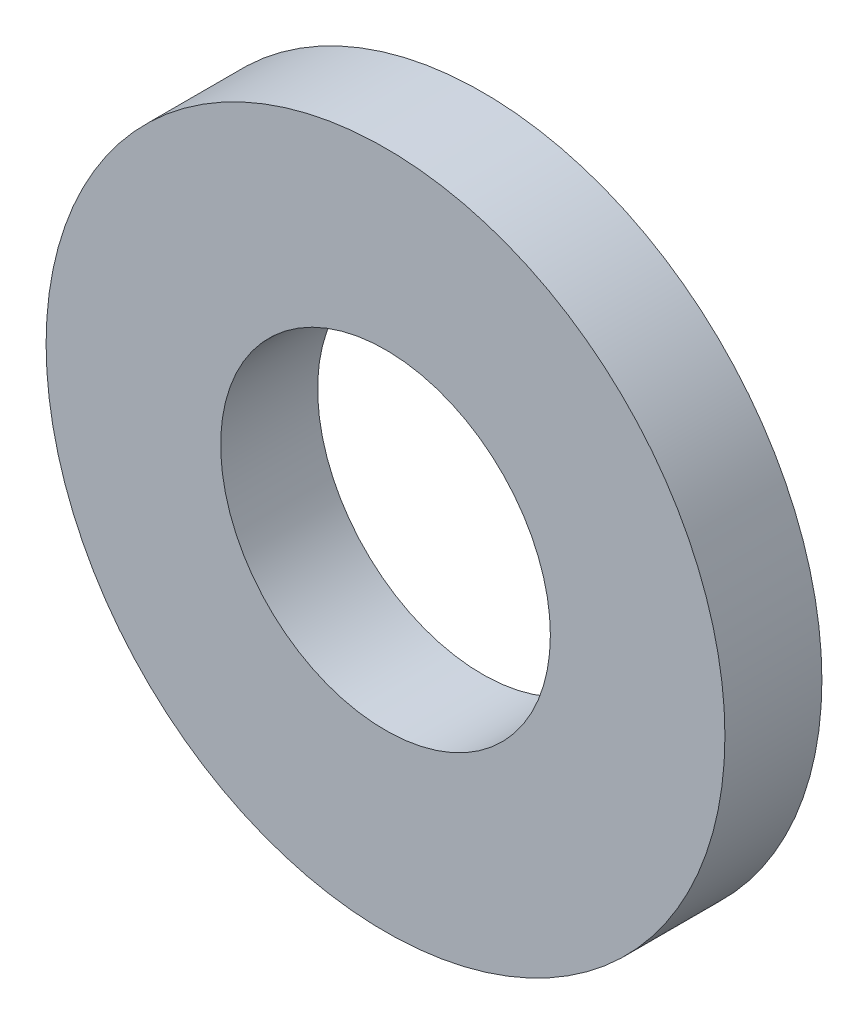
from build123d import *

# Parameters (mm, degrees)
SKETCH_1_R      = 3.5
SKETCH_1_R_2    = 1.7
EXTRUDE_1_DEPTH = 0.5


with BuildPart() as part:
    # 草图1 → 凸台-拉伸1 (new, symmetric)
    with BuildSketch(Plane.XY):
        Circle(SKETCH_1_R)
        Circle(SKETCH_1_R_2, mode=Mode.SUBTRACT)
    extrude(amount=EXTRUDE_1_DEPTH, both=True)


solid = part.part
